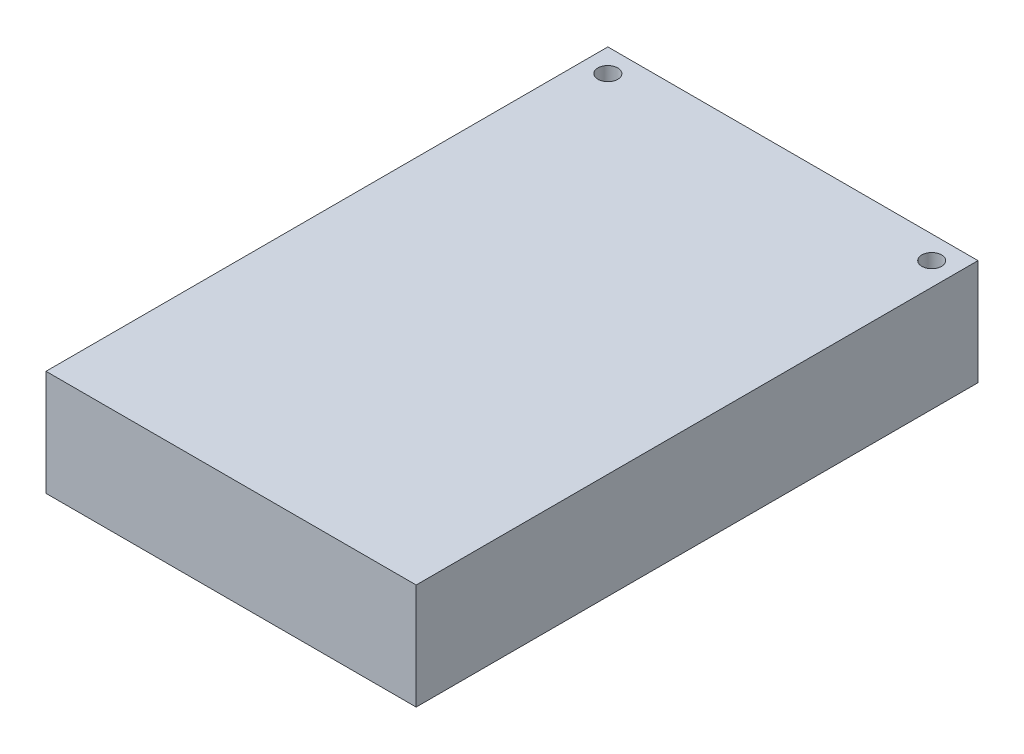
from build123d import *

# Parameters (mm, degrees)
SKETCH_1_W          = 56
SKETCH_1_H          = 16
EXTRUDE_1_DEPTH     = 85
SKETCH_2_R          = 1.5
CUT_EXTRUDE_1_DEPTH = 104.038827633


with BuildPart() as part:
    # 草图1 → 凸台-拉伸1 (new body)
    with BuildSketch(Plane.XY):
        with Locations((28, 8)):
            Rectangle(SKETCH_1_W, SKETCH_1_H)
    extrude(amount=EXTRUDE_1_DEPTH)

    # 草图2 → 切除-拉伸1 (cut, through all)
    with BuildSketch(Plane(origin=(0, 16, 0), x_dir=(1, 0, 0), z_dir=(0, 1, 0))):
        with Locations(Location((3.5, -3.5, 0), (0, 0, 270))):
            Circle(SKETCH_2_R)
        with Locations(Location((52.5, -3.5, 0), (0, 0, 270))):
            Circle(SKETCH_2_R)
    extrude(amount=-CUT_EXTRUDE_1_DEPTH, mode=Mode.SUBTRACT)


solid = part.part
